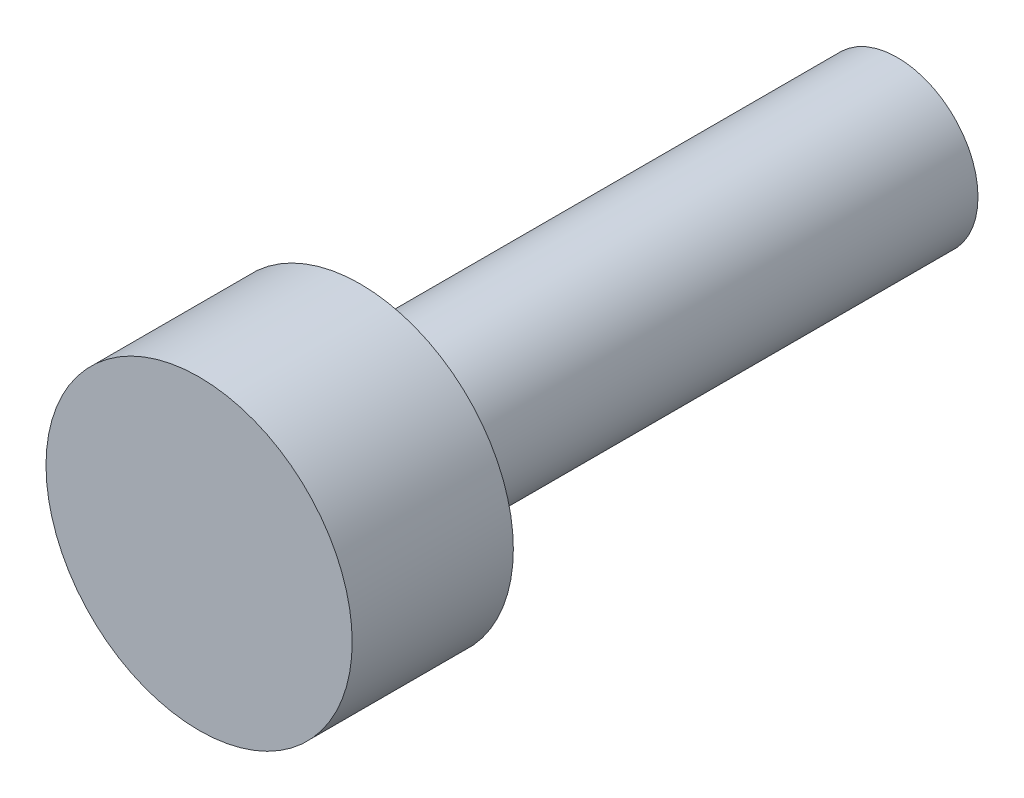
from build123d import *

# Parameters (mm, degrees)
SKETCH1_R           = 1.5
BOSS_EXTRUDE1_DEPTH = 10
SKETCH2_R           = 2.85
BOSS_EXTRUDE2_DEPTH = 3


with BuildPart() as part:
    # Sketch1 → Boss-Extrude1 (new body)
    with BuildSketch(Plane.XY):
        Circle(SKETCH1_R)
    extrude(amount=BOSS_EXTRUDE1_DEPTH)

    # Sketch2 → Boss-Extrude2 (add)
    with BuildSketch(Plane.XY.offset(10)):
        Circle(SKETCH2_R)
    extrude(amount=BOSS_EXTRUDE2_DEPTH)


solid = part.part
